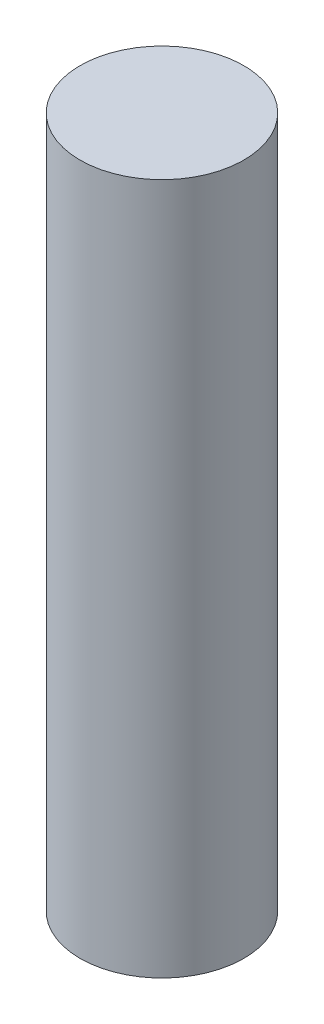
from build123d import *

# Parameters (mm, degrees)
SKETCH1_R           = 9
BOSS_EXTRUDE1_DEPTH = 76


with BuildPart() as part:
    # Sketch1 → Boss-Extrude1 (new body)
    with BuildSketch(Plane(origin=(0, 0, 0), x_dir=(1, 0, 0), z_dir=(0, 1, 0))):
        with Locations(Location((0, 0, 0), (0, 0, 270))):
            Circle(SKETCH1_R)
    extrude(amount=BOSS_EXTRUDE1_DEPTH)


solid = part.part
